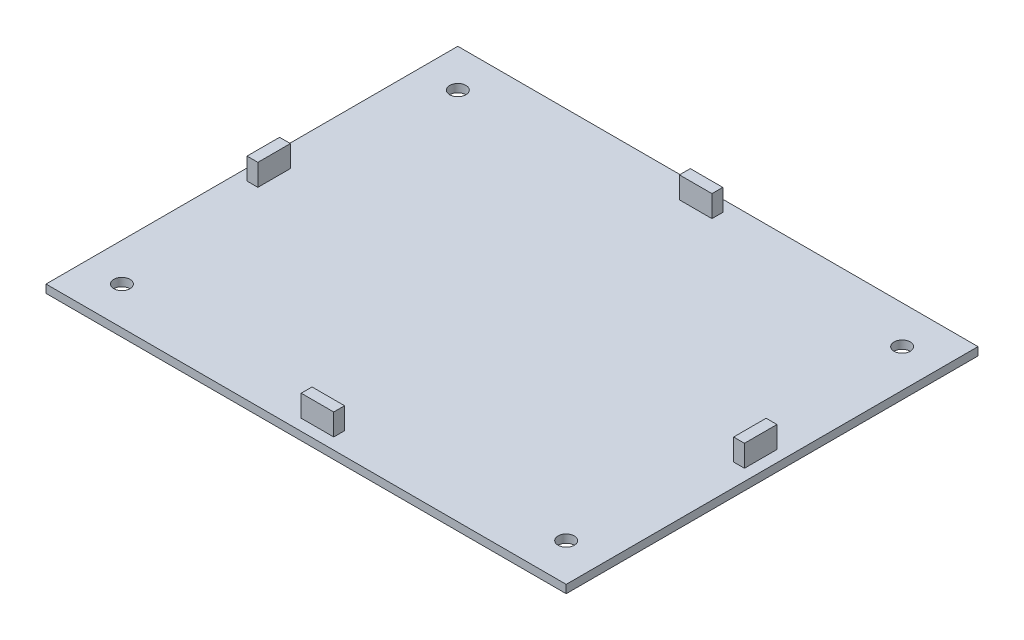
from build123d import *

# Parameters (mm, degrees)
SKETCH1_W               = 96
SKETCH1_H               = 76
BOSS_EXTRUDE1_DEPTH     = 1.5
SKETCH2_W               = 6
SKETCH2_H               = 2
SKETCH2_W_2             = 2
SKETCH2_H_2             = 6
BOSS_EXTRUDE2_DEPTH     = 4
CUT_EXTRUDE1_REACH      = 63.351
SKETCH3_R               = 1.5
MIRROR2_COPY_1_REACH    = 63.351
MIRROR2_COPY_1_SKETCH_R = 1.5


with BuildPart() as part:
    # Sketch1 → Boss-Extrude1 (new body)
    with BuildSketch(Plane(origin=(0, 0, 0), x_dir=(1, 0, 0), z_dir=(0, 1, 0))):
        Rectangle(SKETCH1_W, SKETCH1_H)
    extrude(amount=BOSS_EXTRUDE1_DEPTH)

    # Sketch2 → Boss-Extrude2 (add)
    with BuildSketch(Plane(origin=(0, 1.5, 0), x_dir=(1, 0, 0), z_dir=(0, 1, 0))):
        with Locations((0, 34.9)):
            Rectangle(SKETCH2_W, SKETCH2_H)
        with Locations((-44.9, 0)):
            Rectangle(SKETCH2_W_2, SKETCH2_H_2)
        with Locations((0, -34.9)):
            Rectangle(SKETCH2_W, SKETCH2_H)
        with Locations((44.9, 0)):
            Rectangle(SKETCH2_W_2, SKETCH2_H_2)
    extrude(amount=BOSS_EXTRUDE2_DEPTH)

    # Sketch3 → Cut-Extrude1 (cut, up to next)
    with BuildSketch(Plane(origin=(0, 1.5, 0), x_dir=(1, 0, 0), z_dir=(0, 1, 0)), mode=Mode.PRIVATE) as cut_extrude1_sk1:
        with Locations(Location((-41, -31, 0), (0, 0, 270))):
            Circle(SKETCH3_R)
    cut_extrude1_tool1 = extrude(cut_extrude1_sk1.sketch, amount=-CUT_EXTRUDE1_REACH, mode=Mode.PRIVATE) & part.part
    cut_extrude1 = cut_extrude1_tool1.solids().sort_by_distance((-41, 1.5, 31))[0]
    add(cut_extrude1, mode=Mode.SUBTRACT)

    # Mirror1: Cut-Extrude1 across plane
    add(cut_extrude1.mirror(Plane.XY), mode=Mode.SUBTRACT)

    # Mirror2: Cut-Extrude1 across plane
    add(cut_extrude1.mirror(Plane(origin=(0, 0, 0), x_dir=(0, 0, 1), z_dir=(1, 0, 0))), mode=Mode.SUBTRACT)

    # Mirror2 copy 1 sketch → Mirror2 copy 1 (cut, up to next)
    with BuildSketch(Plane(origin=(0, 1.5, 0), x_dir=(-1, 0, 0), z_dir=(0, 1, 0)), mode=Mode.PRIVATE) as mirror2_copy_1_sk1:
        with Locations(Location((-41, -31, 0), (0, 0, 270))):
            Circle(MIRROR2_COPY_1_SKETCH_R)
    mirror2_copy_1_tool1 = extrude(mirror2_copy_1_sk1.sketch, amount=-MIRROR2_COPY_1_REACH, mode=Mode.PRIVATE) & part.part
    add(mirror2_copy_1_tool1.solids().sort_by_distance((41, 1.5, -31))[0], mode=Mode.SUBTRACT)


solid = part.part
